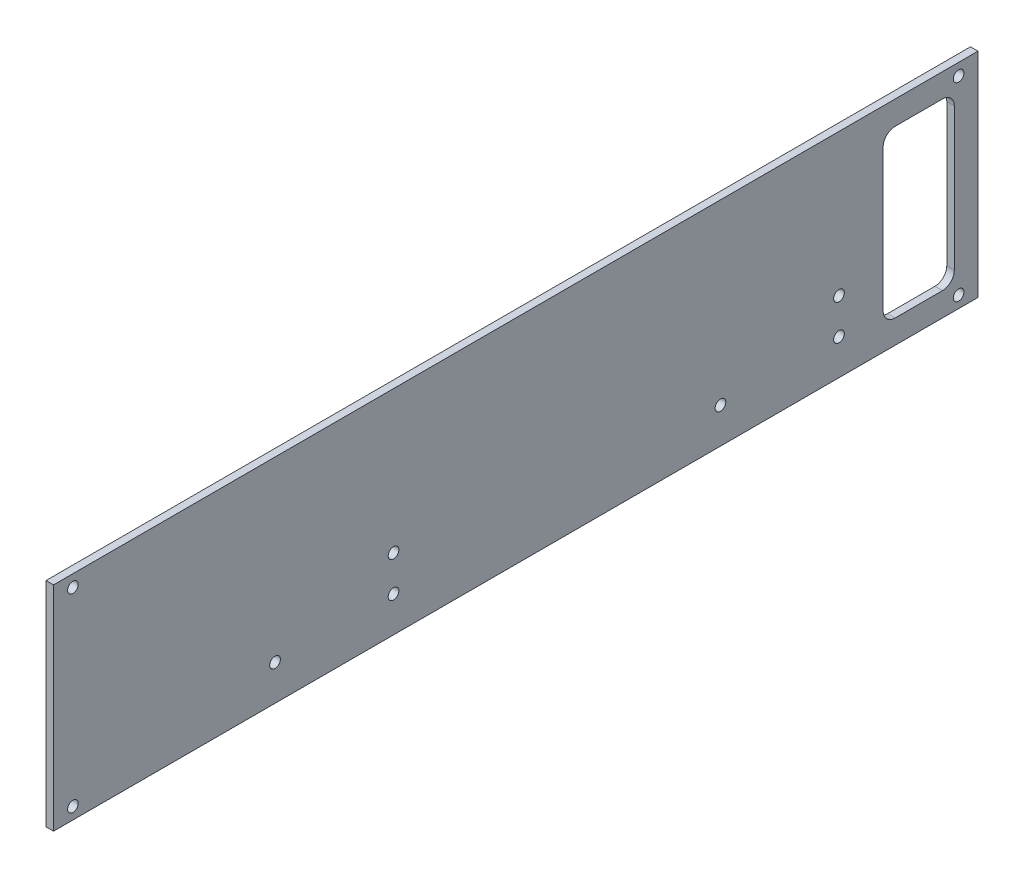
from build123d import *

# Parameters (mm, degrees)
SKETCH1_W                            = 390
SKETCH1_H                            = 90
BOSS_EXTRUDE1_DEPTH                  = 3.175
M4_CLEARANCE_HOLE1_D                 = 4.5
SKETCH4_W                            = 30
SKETCH4_H                            = 70
CUT_EXTRUDE1_DEPTH                   = 201.150145204
FILLET1_R                            = 5
M4_CLEARANCE_HOLE2_D                 = 4.5
MIRROR1_AT_THE_SECOND_PLANE_COPY_1_D = 4.5


with BuildPart() as part:
    # Sketch1 → Boss-Extrude1 (new body)
    with BuildSketch(Plane(origin=(0, 0, 0), x_dir=(0, 0, -1), z_dir=(1, 0, 0))):
        Rectangle(SKETCH1_W, SKETCH1_H)
    extrude(amount=BOSS_EXTRUDE1_DEPTH)

    # M4 Clearance Hole1 (through all)
    with Locations(Plane(origin=(3.175, 0, 0), x_dir=(0, 0, -1), z_dir=(1, 0, 0))):
        with Locations((136.351636823, -15), (-101.563539669, -30), (-51.563539669, -30), (-51.563539669, -15), (86.351636823, -30), (136.351636823, -30)):
            Hole(M4_CLEARANCE_HOLE1_D / 2)

    # Sketch4 → Cut-Extrude1 (cut, through all)
    with BuildSketch(Plane(origin=(3.175, 0, 0), x_dir=(0, 0, -1), z_dir=(1, 0, 0))):
        with Locations((170, 0)):
            Rectangle(SKETCH4_W, SKETCH4_H)
    extrude(amount=-CUT_EXTRUDE1_DEPTH, mode=Mode.SUBTRACT)

    # Fillet1
    fillet1_edges = [part.edges().sort_by_distance(p)[0] for p in [
        (1.5875, 35, -185),
        (1.5875, -35, -185),
        (1.5875, -35, -155),
        (1.5875, 35, -155),
    ]]
    fillet(fillet1_edges, radius=FILLET1_R)

    # M4 Clearance Hole2 (through all)
    with Locations(Plane(origin=(3.175, 0, 0), x_dir=(0, 0, -1), z_dir=(1, 0, 0))):
        with Locations((-186.825, -40)):
            m4_clearance_hole2 = Hole(M4_CLEARANCE_HOLE2_D / 2)

    # Mirror1: M4 Clearance Hole2 across plane
    add(m4_clearance_hole2.mirror(Plane.XY), mode=Mode.SUBTRACT)

    # Mirror1 at the second plane: M4 Clearance Hole2 across plane
    add(m4_clearance_hole2.mirror(Plane.ZX), mode=Mode.SUBTRACT)

    # Mirror1 at the second plane copy 1 (through all)
    with Locations(Plane(origin=(3.175, 0, 0), x_dir=(0, 0, 1), z_dir=(1, 0, 0))):
        with Locations((-186.825, -40)):
            Hole(MIRROR1_AT_THE_SECOND_PLANE_COPY_1_D / 2)


solid = part.part
